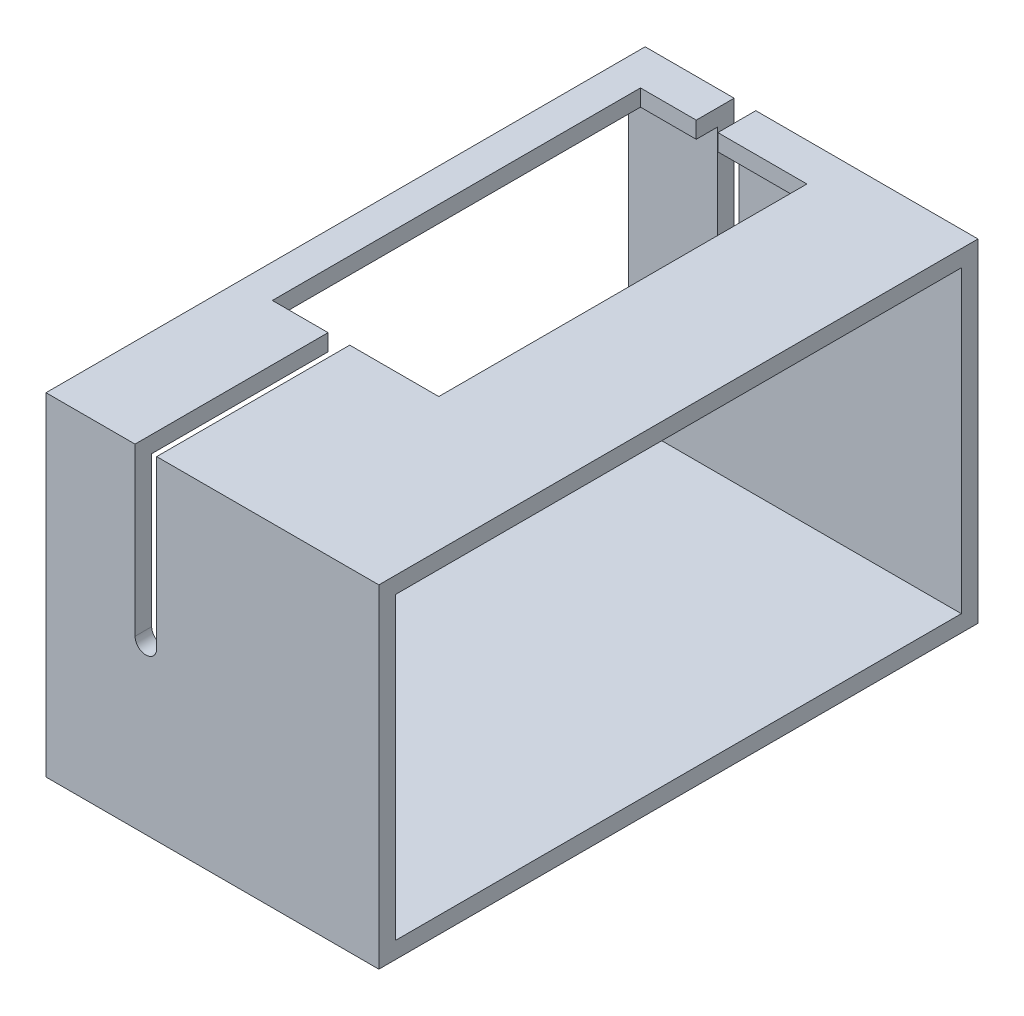
from build123d import *

# Parameters (mm, degrees)
SKETCH_1_W               = 50
SKETCH_1_H               = 90
EXTRUDE_1_DEPTH          = 50
SKETCH_2_W               = 25
SKETCH_2_H               = 55.3
CUT_EXTRUDE_1_DEPTH      = 10
SKETCH_3_W               = 85
SKETCH_3_H               = 45
CUT_EXTRUDE_2_DEPTH      = 84.815273071
CUT_EXTRUDE_3_DEPTH      = 106.948100502
CUT_EXTRUDE_3_DEPTH_BACK = 106.948100502


with BuildPart() as part:
    # 草图1 → 凸台-拉伸1 (new body)
    with BuildSketch(Plane(origin=(0, 0, 0), x_dir=(1, 0, 0), z_dir=(0, 1, 0))):
        Rectangle(SKETCH_1_W, SKETCH_1_H)
    extrude(amount=EXTRUDE_1_DEPTH)

    # 草图2 → 切除-拉伸1 (cut)
    with BuildSketch(Plane(origin=(0, 50, 0), x_dir=(1, 0, 0), z_dir=(0, 1, 0))):
        with Locations((-7.5, 11.65)):
            Rectangle(SKETCH_2_W, SKETCH_2_H)
    extrude(amount=-CUT_EXTRUDE_1_DEPTH, mode=Mode.SUBTRACT)

    # 草图3 → 切除-拉伸2 (cut, through all)
    with BuildSketch(Plane.ZY.offset(25)):
        with Locations((0, 25)):
            Rectangle(SKETCH_3_W, SKETCH_3_H)
    extrude(amount=-CUT_EXTRUDE_2_DEPTH, mode=Mode.SUBTRACT)

    # 草图4 → 切除-拉伸3 (cut, two sides: drawn at the far end of the back side and taken through both)
    with BuildSketch(Plane.XY.offset(45).offset(-CUT_EXTRUDE_3_DEPTH_BACK)):
        with BuildLine():
            Line((-11.625, 25), (-11.625, 50))
            Line((-11.625, 50), (-8.375, 50))
            Line((-8.375, 50), (-8.375, 25))
            ThreePointArc((-8.375, 25), (-10, 23.375), (-11.625, 25))
        make_face()
    extrude(amount=CUT_EXTRUDE_3_DEPTH + CUT_EXTRUDE_3_DEPTH_BACK, mode=Mode.SUBTRACT)


solid = part.part
